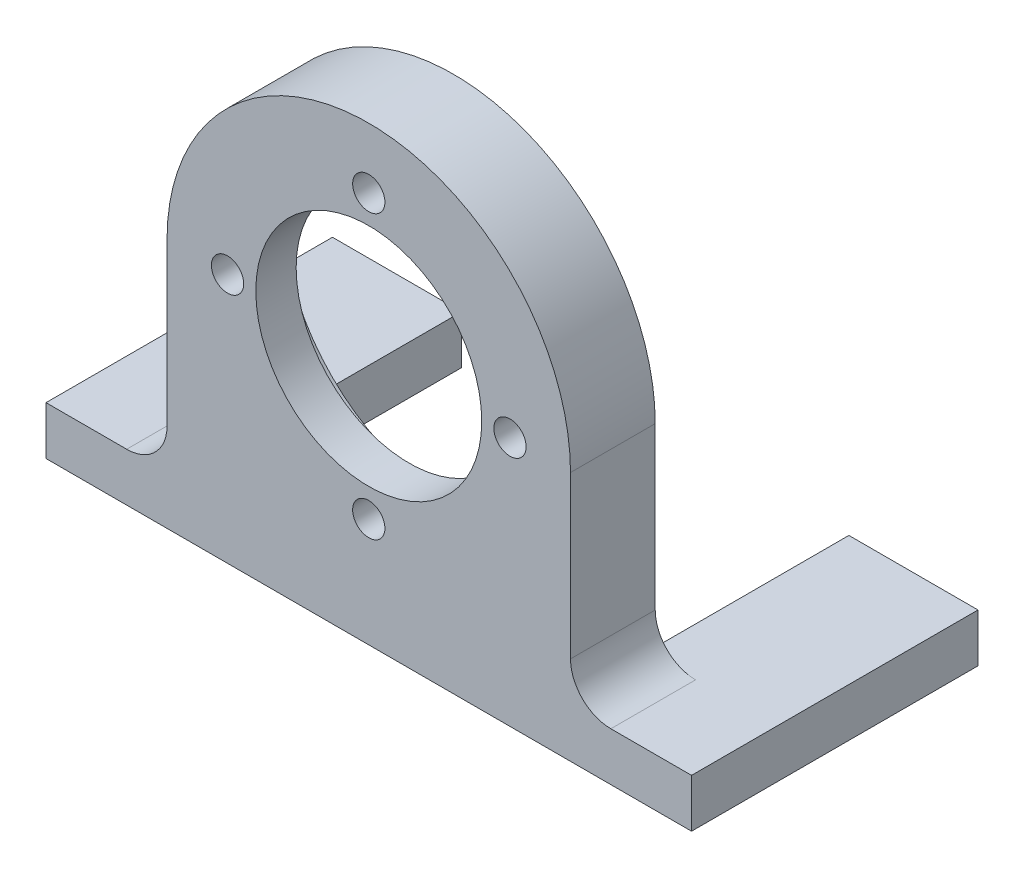
from build123d import *

# Parameters (mm, degrees)
EXTRUDE_1_DEPTH     = 10.5
SKETCH_2_R          = 14
CUT_EXTRUDE_1_DEPTH = 52.684136831
SKETCH_3_R          = 21.25
CUT_EXTRUDE_2_DEPTH = 5.5
SKETCH_4_R          = 2
CUT_EXTRUDE_3_DEPTH = 52.684136831
FILLET_1_R          = 5
SKETCH_5_W          = 16
SKETCH_5_H          = 6
EXTRUDE_2_DEPTH     = 25


with BuildPart() as part:
    # 草图1 → 凸台-拉伸1 (new body)
    with BuildSketch(Plane.XY):
        with BuildLine():
            Line((-25, 0), (-25, -25))
            Line((-25, -25), (-40, -25))
            Line((-40, -25), (-40, -31))
            Line((-40, -31), (40, -31))
            Line((40, -31), (40, -25))
            Line((40, -25), (25, -25))
            Line((25, -25), (25, 0))
            ThreePointArc((25, 0), (0, 25), (-25, 0))
        make_face()
    extrude(amount=EXTRUDE_1_DEPTH)

    # 草图2 → 切除-拉伸1 (cut, through all)
    with BuildSketch(Plane.XY.offset(10.5)):
        Circle(SKETCH_2_R)
    extrude(amount=-CUT_EXTRUDE_1_DEPTH, mode=Mode.SUBTRACT)

    # 草图3 → 切除-拉伸2 (cut)
    with BuildSketch(Plane(origin=(0, 0, 0), x_dir=(-1, 0, 0), z_dir=(0, 0, -1))):
        Circle(SKETCH_3_R)
    extrude(amount=-CUT_EXTRUDE_2_DEPTH, mode=Mode.SUBTRACT)

    # 草图4 → 切除-拉伸3 (cut, through all)
    with BuildSketch(Plane.XY.offset(10.5)):
        with Locations((0, 17.5)):
            Circle(SKETCH_4_R)
        with Locations((17.5, 0)):
            Circle(SKETCH_4_R)
        with Locations((0, -17.5)):
            Circle(SKETCH_4_R)
        with Locations((-17.5, 0)):
            Circle(SKETCH_4_R)
    extrude(amount=-CUT_EXTRUDE_3_DEPTH, mode=Mode.SUBTRACT)

    # 圆角1
    fillet_1_edges = [part.edges().sort_by_distance(p)[0] for p in [
        (25, -25, 5.25),
        (-25, -25, 5.25),
    ]]
    fillet(fillet_1_edges, radius=FILLET_1_R)

    # 草图5 → 凸台-拉伸2 (add)
    with BuildSketch(Plane(origin=(0, 0, 0), x_dir=(-1, 0, 0), z_dir=(0, 0, -1))):
        with Locations((32, -28)):
            Rectangle(SKETCH_5_W, SKETCH_5_H)
        with Locations((-32, -28)):
            Rectangle(SKETCH_5_W, SKETCH_5_H)
    extrude(amount=EXTRUDE_2_DEPTH)


solid = part.part
